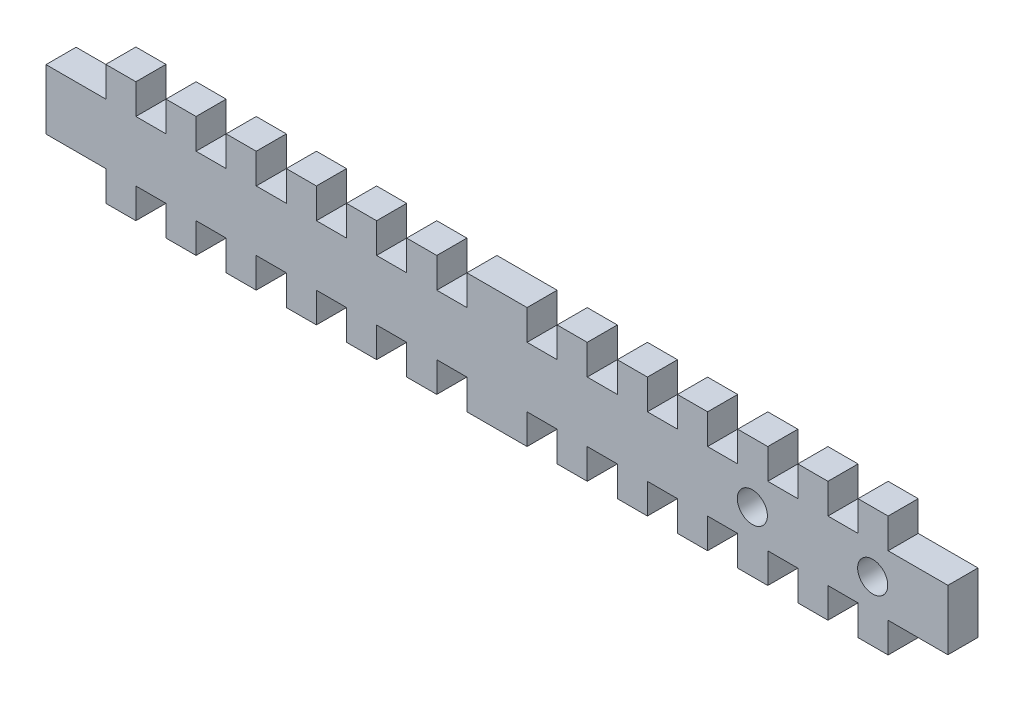
from build123d import *

# Parameters (mm, degrees)
SKETCH1_R           = 3.175
BOSS_EXTRUDE1_DEPTH = 6.35


with BuildPart() as part:
    # Sketch1 → Boss-Extrude1 (new body)
    with BuildSketch(Plane.XY):
        Polygon((-82.55, 12.7), (-76.2, 12.7), (-76.2, 6.35), (-69.85, 6.35), (-69.85, 12.7), (-63.5, 12.7), (-63.5, 6.35), (-57.15, 6.35), (-57.15, 12.7), (-50.8, 12.7), (-50.8, 6.35), (-44.45, 6.35), (-44.45, 12.7), (-38.1, 12.7), (-38.1, 6.35), (-31.75, 6.35), (-31.75, 12.7), (-25.4, 12.7), (-25.4, 6.35), (-19.05, 6.35), (-19.05, 12.7), (-12.7, 12.7), (-12.7, 6.35), (-6.35, 6.35), (-6.35, 12.7), (6.35, 12.7), (6.35, 6.35), (12.7, 6.35), (12.7, 12.7), (19.05, 12.7), (19.05, 6.35), (25.4, 6.35), (25.4, 12.7), (31.75, 12.7), (31.75, 6.35), (38.1, 6.35), (38.1, 12.7), (44.45, 12.7), (44.45, 6.35), (50.8, 6.35), (50.8, 12.7), (57.15, 12.7), (57.15, 6.35), (63.5, 6.35), (63.5, 12.7), (69.85, 12.7), (69.85, 6.35), (76.2, 6.35), (76.2, 12.7), (82.55, 12.7), (82.55, 6.35), (95.167491893, 6.35), (95.167491893, -6.35), (82.55, -6.35), (82.55, -12.7), (76.2, -12.7), (76.2, -6.35), (69.85, -6.35), (69.85, -12.7), (63.5, -12.7), (63.5, -6.35), (57.15, -6.35), (57.15, -12.7), (50.8, -12.7), (50.8, -6.35), (44.45, -6.35), (44.45, -12.7), (38.1, -12.7), (38.1, -6.35), (31.75, -6.35), (31.75, -12.7), (25.4, -12.7), (25.4, -6.35), (19.05, -6.35), (19.05, -12.7), (12.7, -12.7), (12.7, -6.35), (6.35, -6.35), (6.35, -12.7), (-6.35, -12.7), (-6.35, -6.35), (-12.7, -6.35), (-12.7, -12.7), (-19.05, -12.7), (-19.05, -6.35), (-25.4, -6.35), (-25.4, -12.7), (-31.75, -12.7), (-31.75, -6.35), (-38.1, -6.35), (-38.1, -12.7), (-44.45, -12.7), (-44.45, -6.35), (-50.8, -6.35), (-50.8, -12.7), (-57.15, -12.7), (-57.15, -6.35), (-63.5, -6.35), (-63.5, -12.7), (-69.85, -12.7), (-69.85, -6.35), (-76.2, -6.35), (-76.2, -12.7), (-82.55, -12.7), (-82.55, -6.35), (-95.167491893, -6.35), (-95.167491893, 6.35), (-82.55, 6.35), align=None)
        with Locations((79.292491893, 0)):
            Circle(SKETCH1_R, mode=Mode.SUBTRACT)
        with Locations((53.892491893, 0)):
            Circle(SKETCH1_R, mode=Mode.SUBTRACT)
    extrude(amount=BOSS_EXTRUDE1_DEPTH)


solid = part.part
